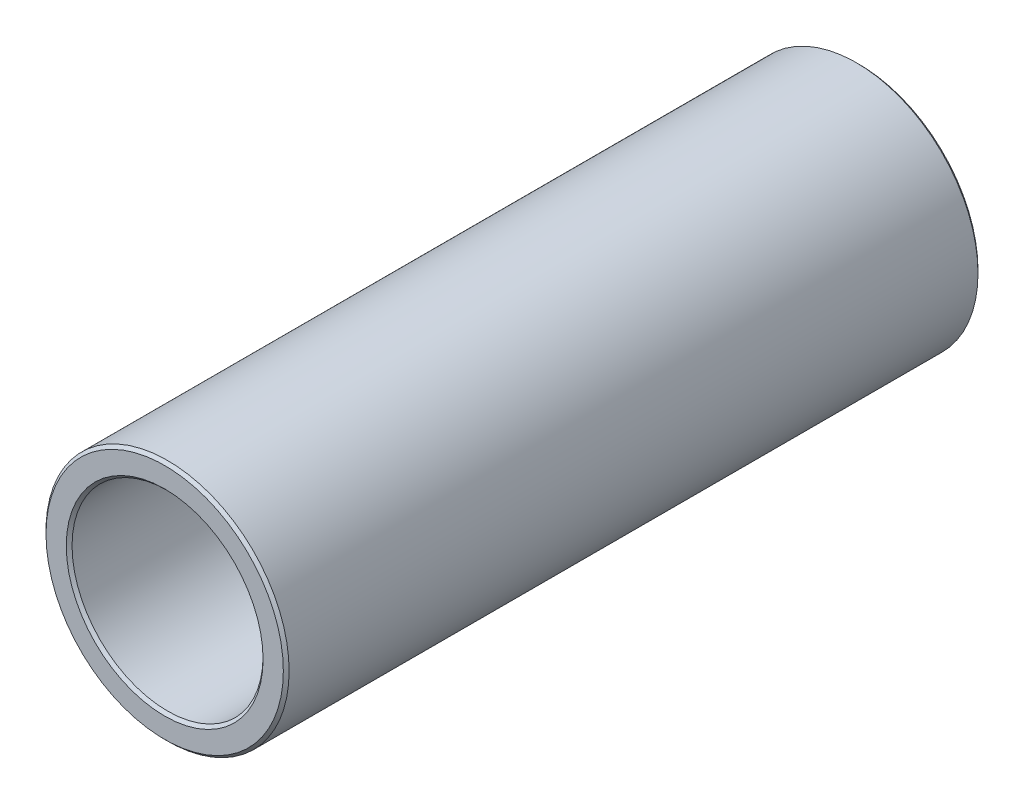
from build123d import *

# Parameters (mm, degrees)
SZKIC1_W = 120
SZKIC1_H = 21


with BuildPart() as part:
    # Szkic1 → Obrót1 (revolve)
    with BuildSketch(Plane(origin=(0, 0, 0), x_dir=(0, 0, -1), z_dir=(1, 0, 0))):
        with Locations((-60, 10.5)):
            Rectangle(SZKIC1_W, SZKIC1_H)
    revolve(axis=Axis((0, 0, 0), (0, 0, 1)))

    # Szkic2 → Wycięcie-obrót1 (revolve, cut)
    with BuildSketch(Plane(origin=(0, 0, 0), x_dir=(0, 0, -1), z_dir=(1, 0, 0))):
        Polygon((-120, 20.5), (-119.5, 21), (-120, 21), align=None)
    revolve(axis=Axis((0, 0, 0), (0, 0, 1)), mode=Mode.SUBTRACT)

    # Szkic3 → Wycięcie-obrót2 (revolve, cut)
    with BuildSketch(Plane(origin=(0, 0, 0), x_dir=(0, 0, -1), z_dir=(1, 0, 0))):
        Polygon((-0.5, 21), (0, 20.5), (0, 21), align=None)
    revolve(axis=Axis((0, 0, 0), (0, 0, 1)), mode=Mode.SUBTRACT)

    # Szkic4 → Wycięcie-obrót3 (revolve, cut)
    with BuildSketch(Plane(origin=(0, 0, 0), x_dir=(0, 0, -1), z_dir=(1, 0, 0))):
        Polygon((-13, 0), (-13, 16.5), (-11.9175, 6.9175), (-1.0825, 6.9175), (0, 8), (0, 0), align=None)
    revolve(axis=Axis((0, 0, 0), (0, 0, 1)), mode=Mode.SUBTRACT)

    # Szkic5 → Wycięcie-obrót4 (revolve, cut)
    with BuildSketch(Plane(origin=(0, 0, 0), x_dir=(0, 0, -1), z_dir=(1, 0, 0))):
        Polygon((-120, 0), (-120, 17), (-119.5, 16.5), (-13, 16.5), (-13, 0), align=None)
    revolve(axis=Axis((0, 0, 13), (0, 0, 1)), mode=Mode.SUBTRACT)


solid = part.part
